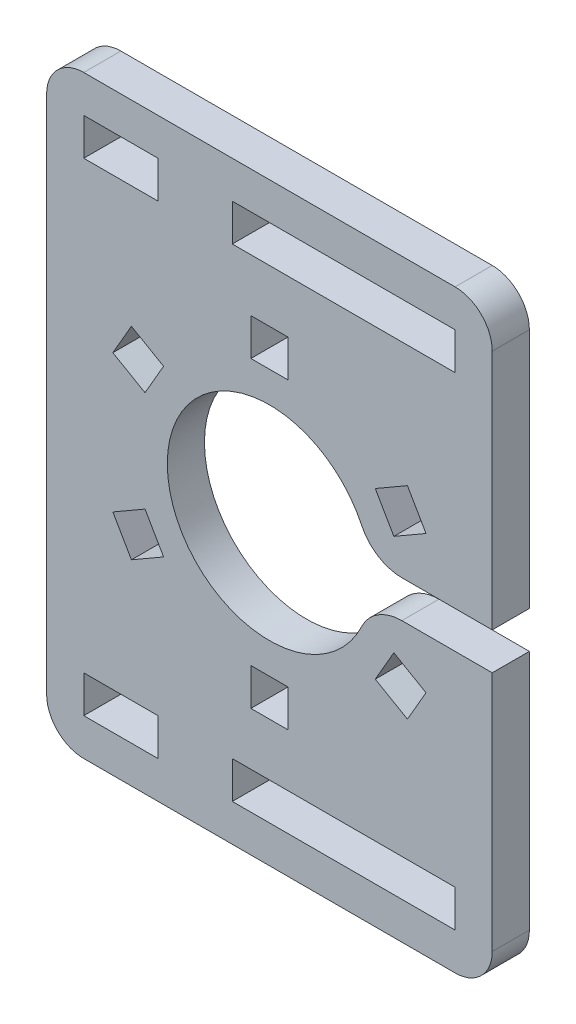
from build123d import *

# Parameters (mm, degrees)
ESQUISSE1_W        = 10
ESQUISSE1_H        = 5
ESQUISSE1_W_2      = 30
ESQUISSE1_W_3      = 5
BOSS_EXTRU_1_DEPTH = 5


with BuildPart() as part:
    # Esquisse1 → Boss.-Extru.1 (new body)
    with BuildSketch(Plane.XY):
        with BuildLine():
            Line((-55, 80), (-5, 80))
            ThreePointArc((-5, 80), (-1.464466094, 78.535533906), (0, 75))
            Line((0, 75), (0, 42.5))
            Line((0, 42.5), (-12.172703514, 42.5))
            ThreePointArc((-12.172703514, 42.5), (-15.374759815, 43.42586604), (-17.588591054, 45.917721519))
            ThreePointArc((-17.588591054, 45.917721519), (-43.75, 40), (-17.588591054, 34.082278481))
            ThreePointArc((-17.588591054, 34.082278481), (-15.374759815, 36.57413396), (-12.172703514, 37.5))
            Line((-12.172703514, 37.5), (0, 37.5))
            Line((0, 37.5), (0, 5))
            ThreePointArc((0, 5), (-1.464466094, 1.464466094), (-5, 0))
            Line((-5, 0), (-55, 0))
            ThreePointArc((-55, 0), (-58.535533906, 1.464466094), (-60, 5))
            Line((-60, 5), (-60, 75))
            ThreePointArc((-60, 75), (-58.535533906, 78.535533906), (-55, 80))
        make_face()
        with Locations((-50, 7.5)):
            Rectangle(ESQUISSE1_W, ESQUISSE1_H, mode=Mode.SUBTRACT)
        with Locations((-20, 7.5)):
            Rectangle(ESQUISSE1_W_2, ESQUISSE1_H, mode=Mode.SUBTRACT)
        with Locations((-20, 72.5)):
            Rectangle(ESQUISSE1_W_2, ESQUISSE1_H, mode=Mode.SUBTRACT)
        with Locations((-50, 72.5)):
            Rectangle(ESQUISSE1_W, ESQUISSE1_H, mode=Mode.SUBTRACT)
        with Locations((-30, 60.4)):
            Rectangle(ESQUISSE1_W_3, ESQUISSE1_H, mode=Mode.SUBTRACT)
        Polygon((-11.418018253, 53.615063509), (-8.918018253, 49.284936491), (-13.248145272, 46.784936491), (-15.748145272, 51.115063509), align=None, mode=Mode.SUBTRACT)
        Polygon((-8.918018253, 30.715063509), (-11.418018253, 26.384936491), (-15.748145272, 28.884936491), (-13.248145272, 33.215063509), align=None, mode=Mode.SUBTRACT)
        with Locations((-30, 19.6)):
            Rectangle(ESQUISSE1_W_3, ESQUISSE1_H, mode=Mode.SUBTRACT)
        Polygon((-48.581981747, 26.384936491), (-51.081981747, 30.715063509), (-46.751854728, 33.215063509), (-44.251854728, 28.884936491), align=None, mode=Mode.SUBTRACT)
        Polygon((-51.081981747, 49.284936491), (-48.581981747, 53.615063509), (-44.251854728, 51.115063509), (-46.751854728, 46.784936491), align=None, mode=Mode.SUBTRACT)
    extrude(amount=BOSS_EXTRU_1_DEPTH)


solid = part.part
